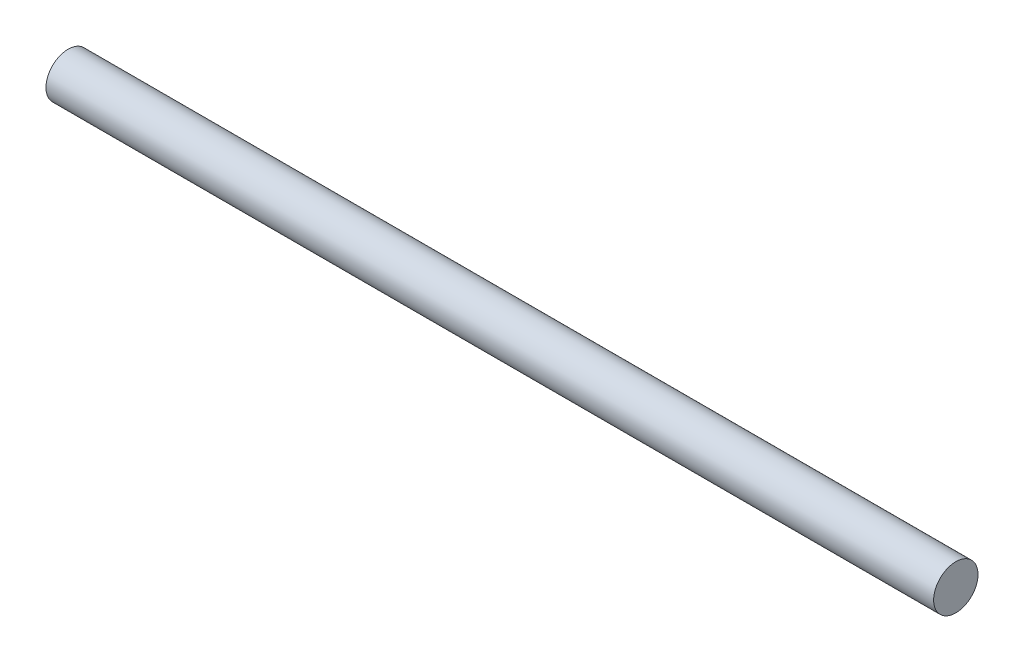
from build123d import *

# Parameters (mm, degrees)
SKETCH1_R           = 0.05
BOSS_EXTRUDE2_DEPTH = 2


with BuildPart() as part:
    # Sketch1 → Boss-Extrude2 (new body)
    with BuildSketch(Plane(origin=(0, 0, 0), x_dir=(0, 0, -1), z_dir=(1, 0, 0))):
        Circle(SKETCH1_R)
    extrude(amount=BOSS_EXTRUDE2_DEPTH)


solid = part.part
